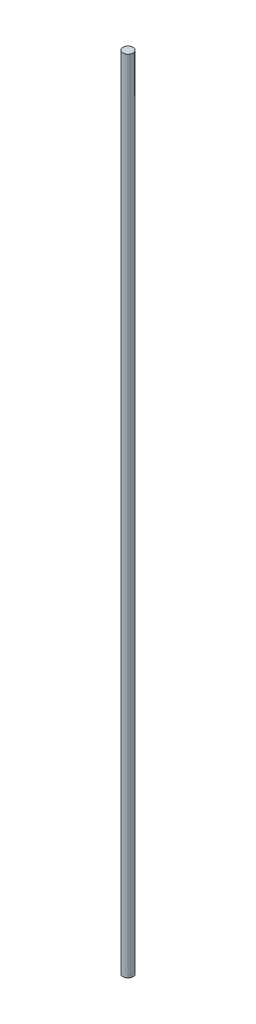
from build123d import *

# Parameters (mm, degrees)
SKETCH1_R           = 3.175
BOSS_EXTRUDE1_DEPTH = 500


with BuildPart() as part:
    # Sketch1 → Boss-Extrude1 (new body)
    with BuildSketch(Plane(origin=(0, 0, 0), x_dir=(1, 0, 0), z_dir=(0, 1, 0))):
        with Locations(Location((0, 0, 0), (0, 0, 270))):
            Circle(SKETCH1_R)
    extrude(amount=BOSS_EXTRUDE1_DEPTH)


solid = part.part
